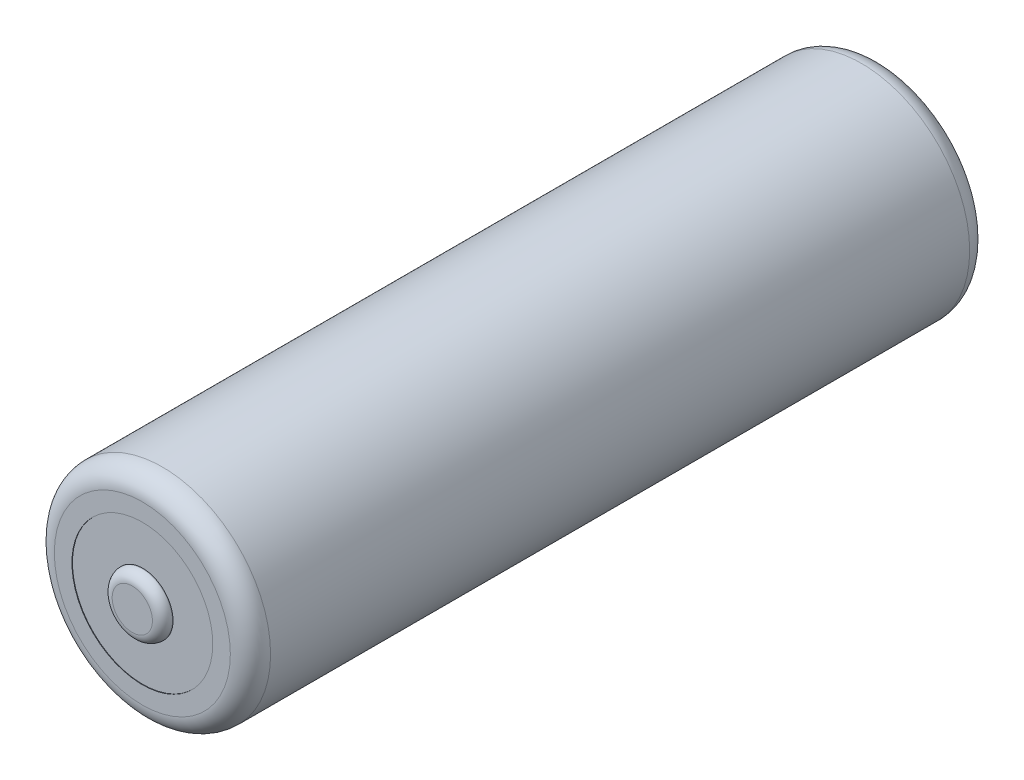
from build123d import *

# Parameters (mm, degrees)
SKETCH1_R           = 10.75
BOSS_EXTRUDE1_DEPTH = 73.5
SKETCH2_R           = 3
BOSS_EXTRUDE2_DEPTH = 1
CUT_EXTRUDE1_START  = -0.05
SKETCH2_3_R         = 7
SKETCH2_3_R_2       = 3
CUT_EXTRUDE1_DEPTH  = 0.05
SKETCH3_R           = 7.5
CUT_EXTRUDE2_DEPTH  = 0.05
FILLET1_R           = 2
FILLET2_R           = 1


with BuildPart() as part:
    # Sketch1 → Boss-Extrude1 (new body)
    with BuildSketch(Plane.XY):
        Circle(SKETCH1_R)
    extrude(amount=BOSS_EXTRUDE1_DEPTH)

    # Sketch2 → Boss-Extrude2 (add)
    with BuildSketch(Plane.XY.offset(73.5)):
        Circle(SKETCH2_R)
    extrude(amount=BOSS_EXTRUDE2_DEPTH)

    # Sketch2<3> → Cut-Extrude1 (cut)
    with BuildSketch(Plane.XY.offset(73.5).offset(CUT_EXTRUDE1_START)):
        Circle(SKETCH2_3_R)
        Circle(SKETCH2_3_R_2, mode=Mode.SUBTRACT)
    extrude(amount=CUT_EXTRUDE1_DEPTH, mode=Mode.SUBTRACT)

    # Sketch3 → Cut-Extrude2 (cut)
    with BuildSketch(Plane(origin=(0, 0, 0), x_dir=(-1, 0, 0), z_dir=(0, 0, -1))):
        Circle(SKETCH3_R)
    extrude(amount=-CUT_EXTRUDE2_DEPTH, mode=Mode.SUBTRACT)

    # Fillet1
    fillet1_edges = [part.edges().sort_by_distance(p)[0] for p in [
        (-10.75, 0, 0),
        (-10.75, 0, 73.5),
    ]]
    fillet(fillet1_edges, radius=FILLET1_R)

    # Fillet2
    fillet2_edges = [part.edges().sort_by_distance(p)[0] for p in [
        (-3, 0, 74.5),
    ]]
    fillet(fillet2_edges, radius=FILLET2_R)


solid = part.part
